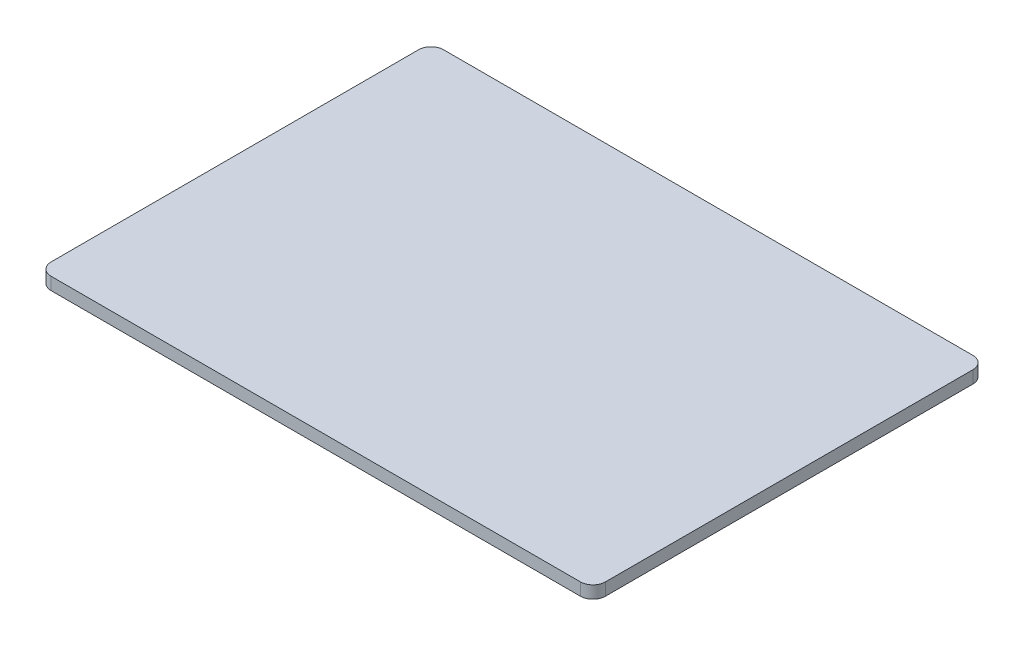
from build123d import *

# Parameters (mm, degrees)
BOSS_EXTRUDE1_DEPTH = 2.54


with BuildPart() as part:
    # Sketch1 → Boss-Extrude1 (new body)
    with BuildSketch(Plane(origin=(0, 0, 0), x_dir=(1, 0, 0), z_dir=(0, 1, 0))):
        with BuildLine():
            Line((2.54, 0), (110.46, 0))
            ThreePointArc((110.46, 0), (112.256051224, 0.743948776), (113, 2.54))
            Line((113, 2.54), (113, 77.46))
            ThreePointArc((113, 77.46), (112.256051224, 79.256051224), (110.46, 80))
            Line((110.46, 80), (2.54, 80))
            ThreePointArc((2.54, 80), (0.743948776, 79.256051224), (0, 77.46))
            Line((0, 77.46), (0, 2.54))
            ThreePointArc((0, 2.54), (0.743948776, 0.743948776), (2.54, 0))
        make_face()
    extrude(amount=BOSS_EXTRUDE1_DEPTH)


solid = part.part
